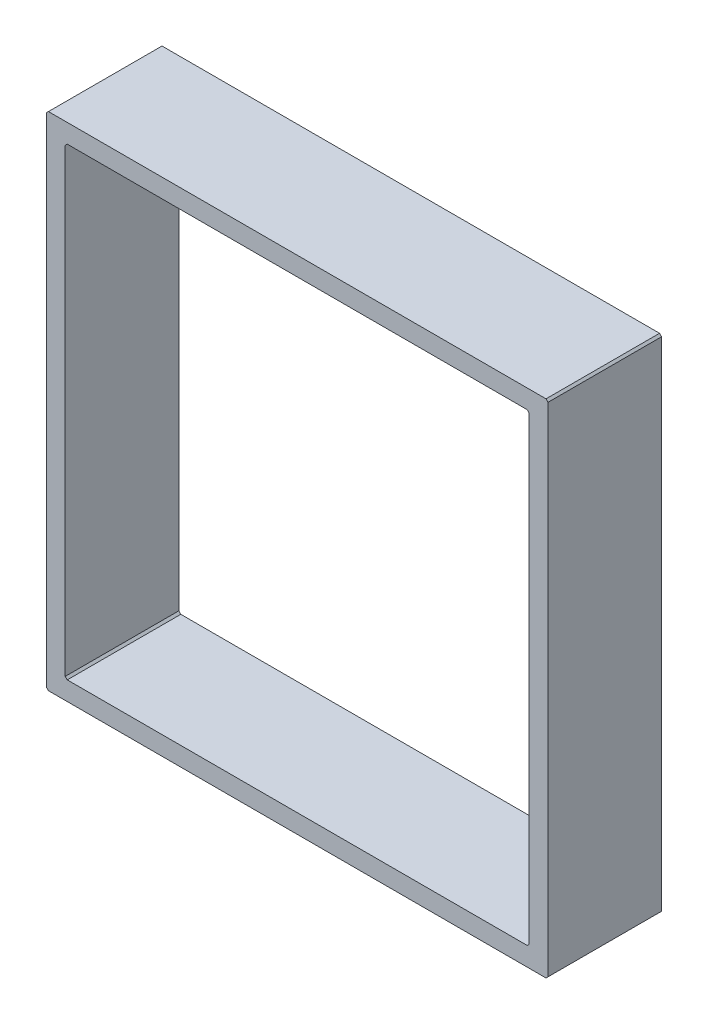
from build123d import *

# Parameters (mm, degrees)
EXTRUDE_THIN1_DEPTH = 14.375
CHAMFER1_SIZE       = 0.508


with BuildPart() as part:
    # Sketch2 → Extrude-Thin1 (new, symmetric)
    with BuildSketch(Plane.XY):
        Polygon((0, 63.5), (-63.5, 63.5), (-63.5, 0), (-58.7375, 0), (-58.7375, 58.7375), (0, 58.7375), align=None)
    extrude(amount=EXTRUDE_THIN1_DEPTH, both=True)

    # Chamfer1
    chamfer1_edges = [part.edges().sort_by_distance(p)[0] for p in [
        (-63.5, 63.5, 0),
        (-58.7375, 58.7375, 0),
    ]]
    chamfer(chamfer1_edges, length=CHAMFER1_SIZE)

    # Mirror1: part across plane


with BuildPart() as part_1:
    add(part.part)
    add(part.part.mirror(Plane(origin=(0, 63.5, 14.375), x_dir=(0, 0, 1), z_dir=(1, 0, 0))))

    # Mirror2: part across plane


with BuildPart() as part_2:
    add(part_1.part)
    add(part_1.part.mirror(Plane(origin=(-58.7375, 0, 14.375), x_dir=(0, 0, 1), z_dir=(0, -1, 0))))


solid = part_2.part
